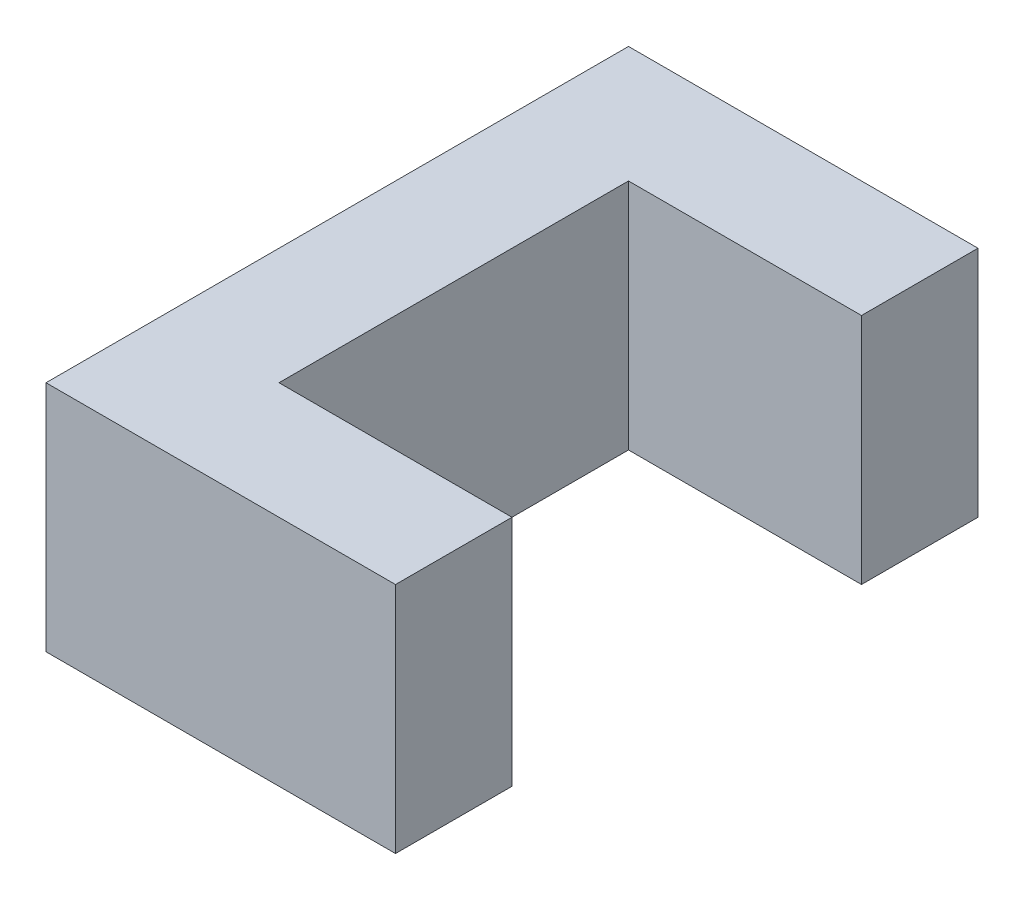
from build123d import *

# Parameters (mm, degrees)
BOSS_EXTRUDE1_DEPTH = 20


with BuildPart() as part:
    # Sketch1 → Boss-Extrude1 (new body)
    with BuildSketch(Plane(origin=(0, 0, 0), x_dir=(1, 0, 0), z_dir=(0, 1, 0))):
        Polygon((0, 0), (0, -50), (30, -50), (30, -40), (10, -40), (10, -10), (30, -10), (30, 0), align=None)
    extrude(amount=BOSS_EXTRUDE1_DEPTH)


solid = part.part
